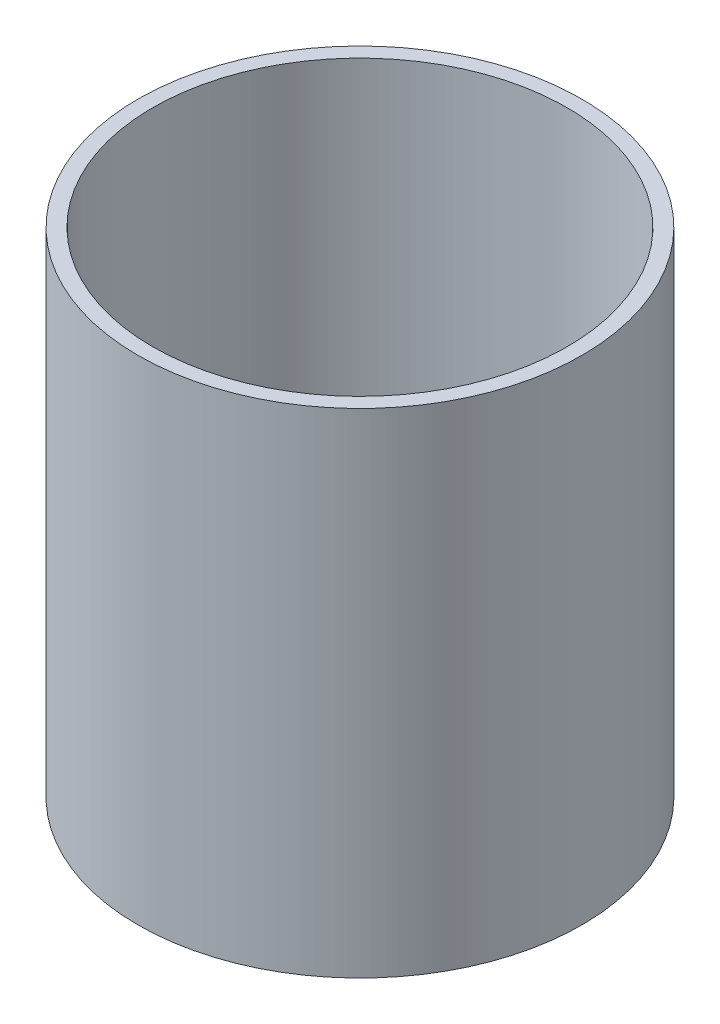
from build123d import *

# Parameters (mm, degrees)
SKETCH_1_R      = 22.5
SKETCH_1_R_2    = 21
EXTRUDE_1_DEPTH = 50


with BuildPart() as part:
    # 草图1 → 凸台-拉伸1 (new body)
    with BuildSketch(Plane(origin=(0, 0, 0), x_dir=(1, 0, 0), z_dir=(0, 1, 0))):
        with Locations(Location((0, 0, 0), (0, 0, 270))):
            Circle(SKETCH_1_R)
        with Locations(Location((0, 0, 0), (0, 0, 270))):
            Circle(SKETCH_1_R_2, mode=Mode.SUBTRACT)
    extrude(amount=EXTRUDE_1_DEPTH)


solid = part.part
